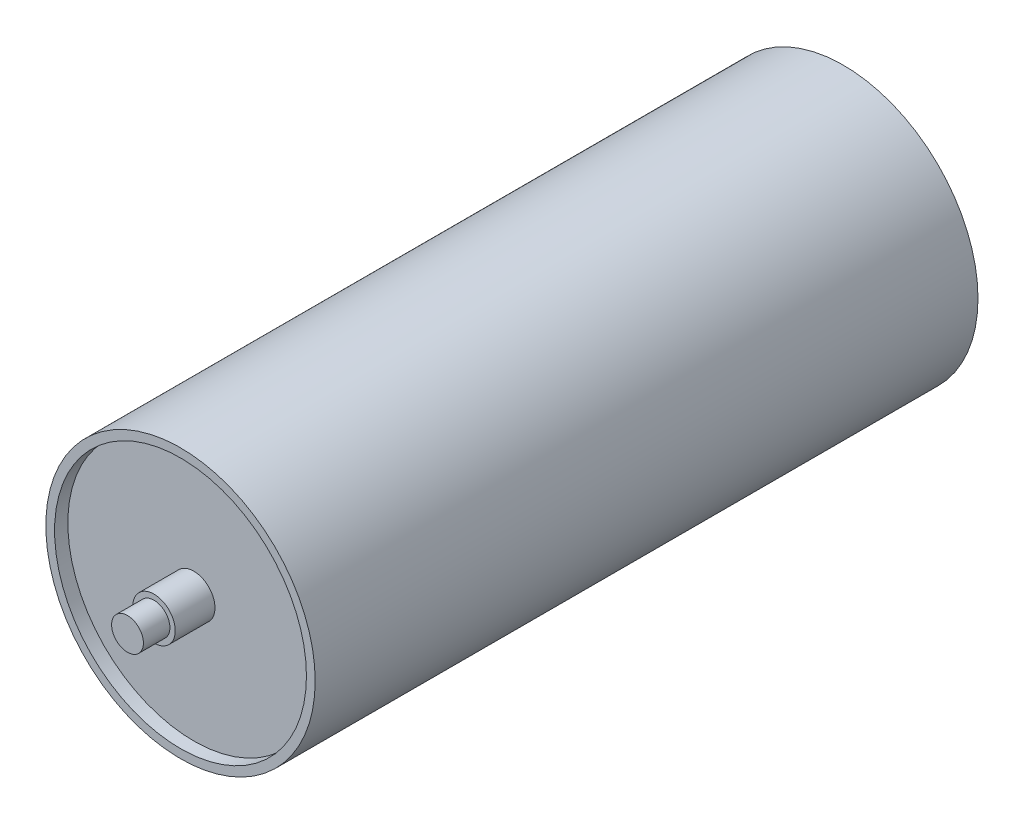
from build123d import *

# Parameters (mm, degrees)
SKETCH1_R           = 50.8
BOSS_EXTRUDE1_DEPTH = 250
SKETCH2_R           = 47.5
CUT_EXTRUDE1_DEPTH  = 5
CUT_EXTRUDE2_START  = -5
SKETCH3_R           = 47.5
CUT_EXTRUDE2_DEPTH  = 5
SKETCH4_R           = 8
BOSS_EXTRUDE2_DEPTH = 15
BOSS_EXTRUDE3_START = 15
SKETCH5_R           = 8
BOSS_EXTRUDE3_DEPTH = 15
SKETCH7_R           = 6
BOSS_EXTRUDE4_DEPTH = 10
BOSS_EXTRUDE5_START = 10
SKETCH8_R           = 6
BOSS_EXTRUDE5_DEPTH = 10


with BuildPart() as part:
    # Sketch1 → Boss-Extrude1 (new body)
    with BuildSketch(Plane.XY):
        Circle(SKETCH1_R)
    extrude(amount=BOSS_EXTRUDE1_DEPTH)

    # Sketch2 → Cut-Extrude1 (cut)
    with BuildSketch(Plane.XY.offset(250)):
        Circle(SKETCH2_R)
    extrude(amount=-CUT_EXTRUDE1_DEPTH, mode=Mode.SUBTRACT)

    # Sketch3 → Cut-Extrude2 (cut)
    with BuildSketch(Plane(origin=(0, 0, 0), x_dir=(-1, 0, 0), z_dir=(0, 0, -1)).offset(CUT_EXTRUDE2_START)):
        with Locations(Location((0, 0, 0), (0, 0, 180))):
            Circle(SKETCH3_R)
    extrude(amount=CUT_EXTRUDE2_DEPTH, mode=Mode.SUBTRACT)

    # Sketch4 → Boss-Extrude2 (add)
    with BuildSketch(Plane(origin=(0, 0, 5), x_dir=(-1, 0, 0), z_dir=(0, 0, -1))):
        Circle(SKETCH4_R)
    extrude(amount=BOSS_EXTRUDE2_DEPTH)

    # Sketch5 → Boss-Extrude3 (add)
    with BuildSketch(Plane.XY.offset(245).offset(BOSS_EXTRUDE3_START)):
        with Locations(Location((0, 0, 0), (0, 0, 180))):
            Circle(SKETCH5_R)
    extrude(amount=-BOSS_EXTRUDE3_DEPTH)

    # Sketch7 → Boss-Extrude4 (add)
    with BuildSketch(Plane(origin=(0, 0, -10), x_dir=(-1, 0, 0), z_dir=(0, 0, -1))):
        Circle(SKETCH7_R)
    extrude(amount=BOSS_EXTRUDE4_DEPTH)

    # Sketch8 → Boss-Extrude5 (add)
    with BuildSketch(Plane.XY.offset(260).offset(BOSS_EXTRUDE5_START)):
        with Locations(Location((0, 0, 0), (0, 0, 180))):
            Circle(SKETCH8_R)
    extrude(amount=-BOSS_EXTRUDE5_DEPTH)


solid = part.part
